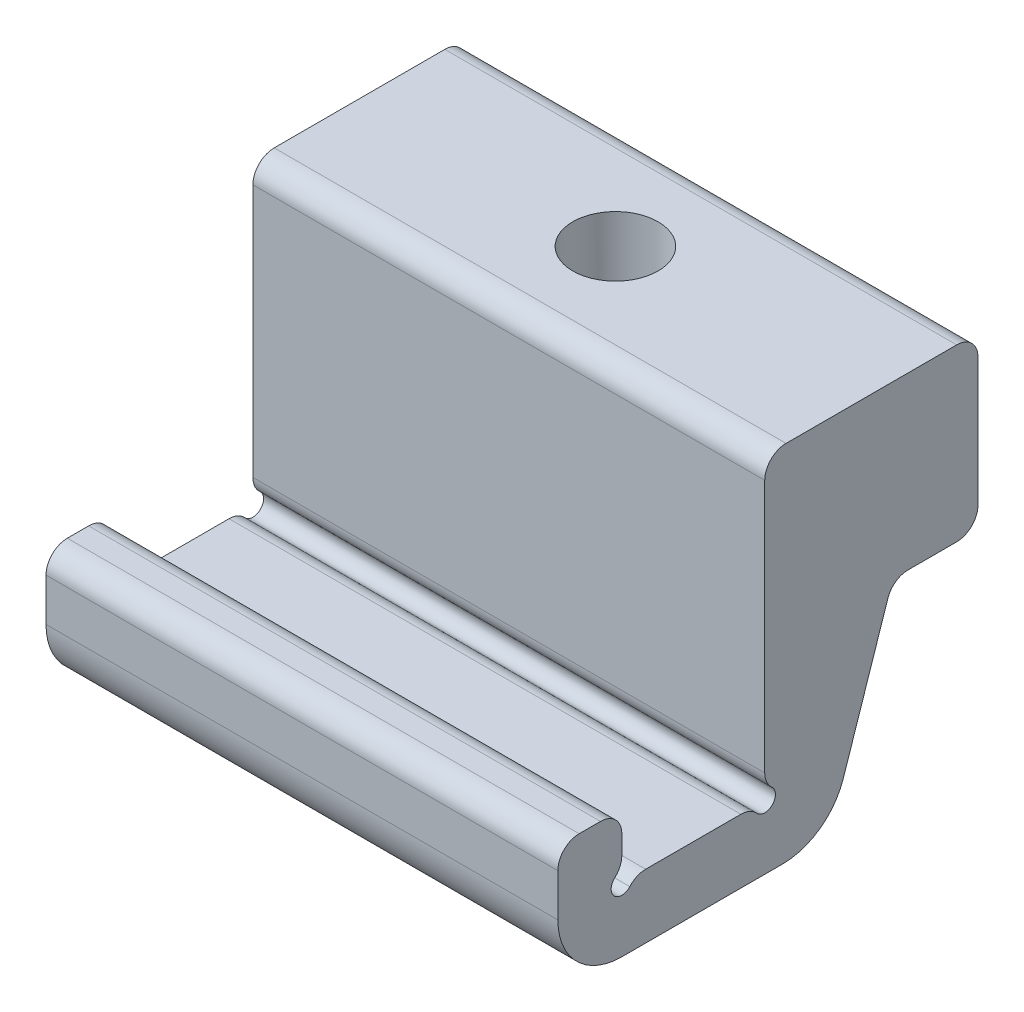
from build123d import *

# Parameters (mm, degrees)
BOSS_EXTRUDE1_DEPTH = 12
FILLET1_R           = 3
SKETCH4_R           = 0.5
CUT_EXTRUDE3_DEPTH  = 121.732141537
FILLET2_R           = 1
FILLET3_R           = 1
FILLET4_R           = 1
FILLET6_R           = 1
SKETCH2_R           = 2
CUT_EXTRUDE1_DEPTH  = 122.116679281
SKETCH6_R           = 2
CUT_EXTRUDE4_DEPTH  = 8
CUT_EXTRUDE5_DEPTH  = 3.25


with BuildPart() as part:
    # Sketch1 → Boss-Extrude1 (new, symmetric)
    with BuildSketch(Plane(origin=(-107.5, 40, 0), x_dir=(0, 0, -1), z_dir=(1, 0, 0))):
        Polygon((-6.7, -37), (-6.7, -40), (0, -40), (0, -26), (10, -26), (10, -34), (6, -34), (3, -43), (-9.7, -43), (-9.7, -37), align=None)
    extrude(amount=BOSS_EXTRUDE1_DEPTH, both=True)

    # Fillet1
    fillet1_edges = [part.edges().sort_by_distance(p)[0] for p in [
        (-107.5, -3, -3),
        (-107.5, -3, 9.7),
    ]]
    fillet(fillet1_edges, radius=FILLET1_R)

    # Sketch4 → Cut-Extrude3 (cut, through all)
    with BuildSketch(Plane(origin=(0, 0, 0), x_dir=(0, 0, -1), z_dir=(1, 0, 0))):
        with Locations((-6.7, 0)):
            Circle(SKETCH4_R)
        Circle(SKETCH4_R)
    extrude(amount=-CUT_EXTRUDE3_DEPTH, mode=Mode.SUBTRACT)

    # Fillet2
    fillet2_edges = [part.edges().sort_by_distance(p)[0] for p in [
        (-107.5, 0, 6.2),
        (-107.5, 0.5, 6.7),
        (-107.5, 0.5, 0),
        (-107.5, 0, 0.5),
    ]]
    fillet(fillet2_edges, radius=FILLET2_R)

    # Fillet3
    fillet3_edges = [part.edges().sort_by_distance(p)[0] for p in [
        (-107.5, 3, 6.7),
        (-107.5, 3, 9.7),
    ]]
    fillet(fillet3_edges, radius=FILLET3_R)

    # Fillet4
    fillet4_edges = [part.edges().sort_by_distance(p)[0] for p in [
        (-107.5, 14, 0),
        (-107.5, 14, -10),
    ]]
    fillet(fillet4_edges, radius=FILLET4_R)

    # Fillet6
    fillet6_edges = [part.edges().sort_by_distance(p)[0] for p in [
        (-107.5, 6, -10),
        (-107.5, 6, -6),
    ]]
    fillet(fillet6_edges, radius=FILLET6_R)

    # Sketch2 → Cut-Extrude1 (cut, through all)
    with BuildSketch(Plane.XZ.offset(-14)):
        with Locations(Location((-107.5, -5, 0), (0, 0, 41.156184936))):
            Circle(SKETCH2_R)
    extrude(amount=CUT_EXTRUDE1_DEPTH, mode=Mode.SUBTRACT)

    # Sketch6 → Cut-Extrude4 (cut)
    with BuildSketch(Plane(origin=(0, 0, -10), x_dir=(-1, 0, 0), z_dir=(0, 0, -1))):
        with Locations((115.5, 10)):
            Circle(SKETCH6_R)
        with Locations((99.5, 10)):
            Circle(SKETCH6_R)
    extrude(amount=-CUT_EXTRUDE4_DEPTH, mode=Mode.SUBTRACT)

    # Sketch7 → Cut-Extrude5 (cut, symmetric)
    with BuildSketch(Plane(origin=(-107.5, 40, 0), x_dir=(0, 0, -1), z_dir=(1, 0, 0))):
        Polygon((1.88130822, -30.5), (8.38130822, -30.5), (10, -30.5), (10, -43), (8.38130822, -43), (1.88130822, -43), align=None)
    extrude(amount=CUT_EXTRUDE5_DEPTH, both=True, mode=Mode.SUBTRACT)


solid = part.part
